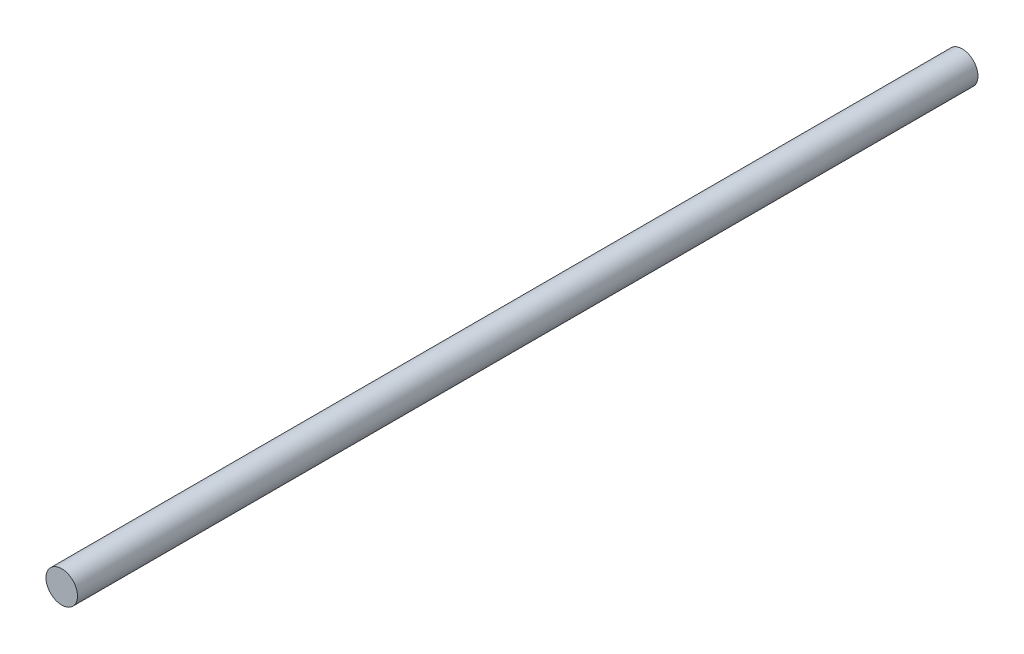
from build123d import *

# Parameters (mm, degrees)
SKETCH_1_R      = 1.75
EXTRUDE_1_DEPTH = 100


with BuildPart() as part:
    # Эскиз1 → Вытянуть1 (new body)
    with BuildSketch(Plane.XY):
        Circle(SKETCH_1_R)
    extrude(amount=EXTRUDE_1_DEPTH)


solid = part.part
